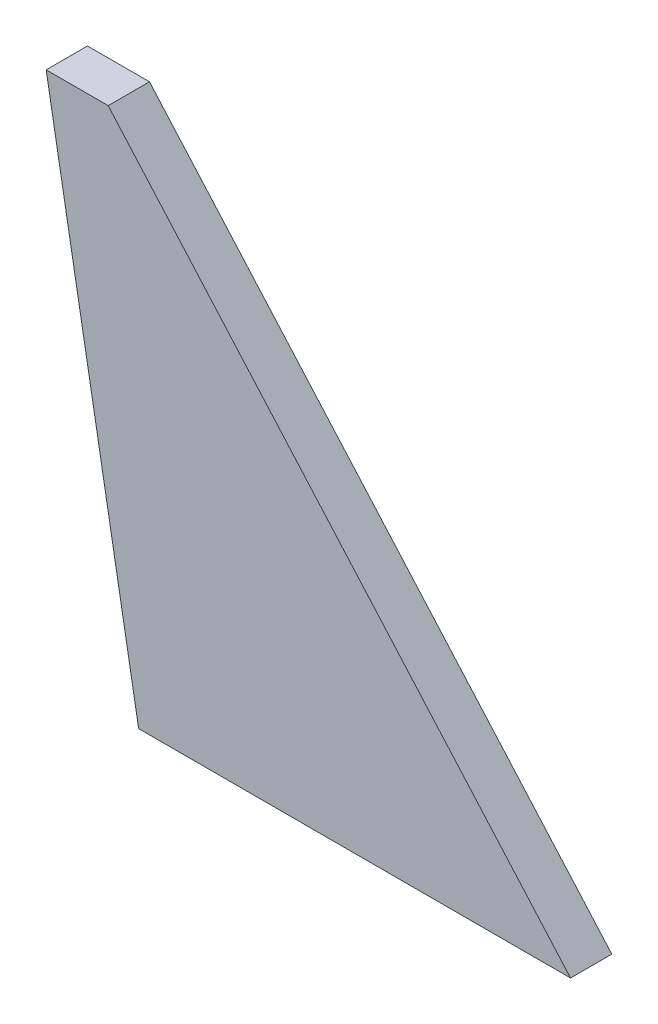
from build123d import *

# Parameters (mm, degrees)
BOSS_EXTRUDE2_DEPTH = 2


with BuildPart() as part:
    # Sketch1 → Boss-Extrude2 (new body)
    with BuildSketch(Plane.XY):
        Polygon((0, 25.4), (4.47870531, 0), (25.4, 0), (3.003546374, 25.4), align=None)
    extrude(amount=BOSS_EXTRUDE2_DEPTH)


solid = part.part
